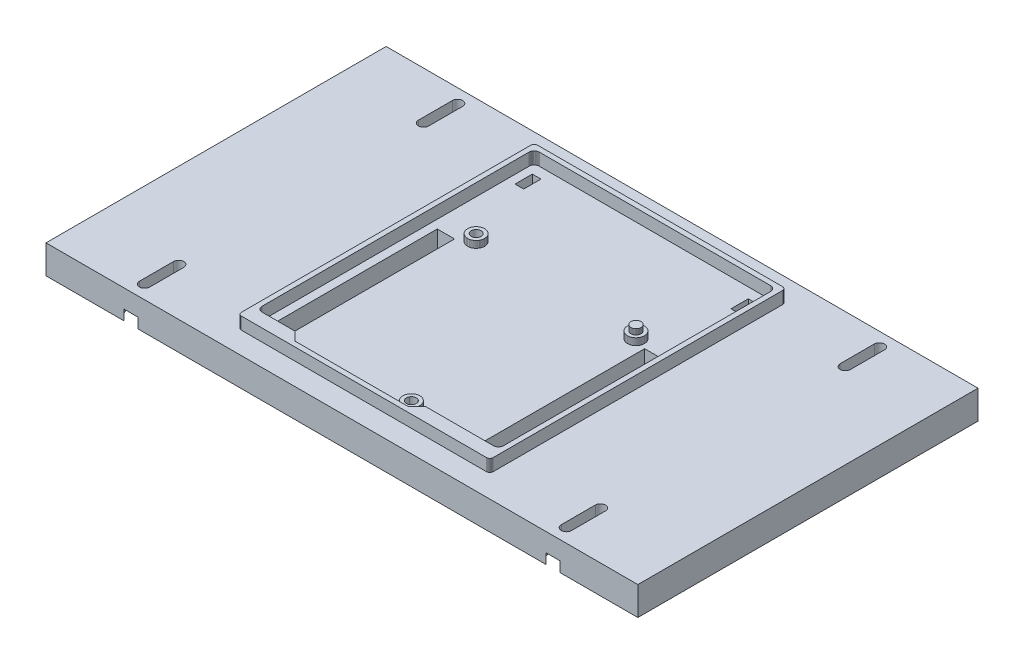
from build123d import *

# Parameters (mm, degrees)
BOSS_EXTRUDE1_DEPTH     = 12.000000104
CUT_EXTRUDE1_DEPTH      = 3.600000404
BOSS_EXTRUDE2_DEPTH     = 2.000000328
BOSS_EXTRUDE3_DEPTH     = 1.600000076
BOSS_EXTRUDE4_DEPTH     = 2.000000328
CUT_EXTRUDE2_DEPTH      = 8.399999933
BOSS_EXTRUDE5_DEPTH     = 2.000000328
CUT_EXTRUDE3_DEPTH      = 8.399999933
SKETCH9_W               = 2.539999783
SKETCH9_H               = 5.079999566
CUT_EXTRUDE4_DEPTH      = 6.399999605
SKETCH10_W              = 5.079999566
SKETCH10_H              = 48.259995878
CUT_EXTRUDE5_DEPTH      = 6.399999605
SKETCH11_W              = 2.540001646
SKETCH11_H              = 5.079999566
CUT_EXTRUDE6_DEPTH      = 6.399999605
SKETCH12_W              = 5.080001429
SKETCH12_H              = 48.259995878
CUT_EXTRUDE7_DEPTH      = 6.399999605
SKETCH13_W              = 174.000000954
SKETCH13_H              = 100
BOSS_EXTRUDE6_DEPTH     = 8.3999997
CUT_EXTRUDE8_DEPTH      = 156.634156294
CUT_EXTRUDE8_DEPTH_BACK = 156.634156294
SKETCH14_R              = 1.450002193
CUT_EXTRUDE9_DEPTH      = 3
CUT_EXTRUDE9_DEPTH_BACK = 156.634156294
CUT_EXTRUDE9_START      = -2
SKETCH14_4_R            = 5


with BuildPart() as part:
    # Sketch1 → Boss-Extrude1 (new body)
    with BuildSketch(Plane.XZ):
        Polygon((72.999998927, 87.039999664), (1.000002027, 87.039999664), (0.826351345, 87.02480793), (0.657979341, 86.979687214), (0.500001013, 86.906030774), (0.357214361, 86.806043983), (0.233955681, 86.682789028), (0.13397634, 86.539998651), (0.060308725, 86.38201654), (0.015191734, 86.213648319), (0, 86.039997637), (0, 0.999998301), (0.015191734, 0.826351345), (0.060308725, 0.657979341), (0.13397634, 0.500001013), (0.233955681, 0.357210636), (0.357214361, 0.233955681), (0.500001013, 0.133972615), (0.657979341, 0.060308725), (0.826351345, 0.015191734), (1.000002027, 0), (72.999998927, 0), (73.173649609, 0.015191734), (73.342017829, 0.060308725), (73.49999994, 0.133972615), (73.642782867, 0.233955681), (73.766045272, 0.357210636), (73.866024613, 0.500001013), (73.939688504, 0.657979341), (73.98480922, 0.826351345), (74.000000954, 0.999998301), (74.000000954, 86.039997637), (73.98480922, 86.213648319), (73.939688504, 86.38201654), (73.866024613, 86.539998651), (73.766045272, 86.682789028), (73.642782867, 86.806043983), (73.49999994, 86.906030774), (73.342017829, 86.979687214), (73.173649609, 87.02480793), align=None)
    extrude(amount=-BOSS_EXTRUDE1_DEPTH)

    # Sketch2 → Cut-Extrude1 (cut)
    with BuildSketch(Plane(origin=(0, 12.000000104, 0), x_dir=(-1, 0, 0), z_dir=(0, 1, 0))):
        Polygon((-72.477214038, 81.760473549), (-72.499997914, 81.500001252), (-72.499997914, 2.999998629), (-72.481527925, 2.765346318), (-72.426579893, 2.536475658), (-72.336509824, 2.319015563), (-72.21352309, 2.118322998), (-72.060659528, 1.939341426), (-71.88167423, 1.786474138), (-71.680985391, 1.66349113), (-71.463525295, 1.57341361), (-71.23465091, 1.518465462), (-71.000002325, 1.499999315), (-2.999998629, 1.499999315), (-2.765350044, 1.518465462), (-2.536475658, 1.57341361), (-2.319015563, 1.66349113), (-2.118322998, 1.786474138), (-1.939341426, 1.939341426), (-1.786474138, 2.118322998), (-1.66349113, 2.319015563), (-1.573417336, 2.536475658), (-1.518469304, 2.765346318), (-1.499999315, 2.999998629), (-1.499999315, 81.500001252), (-1.522790641, 81.760473549), (-1.590460539, 82.01303333), (-1.700963825, 82.249999046), (-1.850932837, 82.464180887), (-2.035818994, 82.649067044), (-2.250001067, 82.799039781), (-2.486970276, 82.909539342), (-2.739530057, 82.977212965), (-2.999998629, 82.999996841), (-12.662893161, 82.999996841), (-15.202892944, 85.540004075), (-48.617105931, 85.540004075), (-51.157109439, 82.999996841), (-71.000002325, 82.999996841), (-71.260467172, 82.977212965), (-71.513034403, 82.909539342), (-71.750000119, 82.799039781), (-71.96418196, 82.649067044), (-72.149068117, 82.464180887), (-72.299033403, 82.249999046), (-72.409540415, 82.01303333), align=None)
    extrude(amount=-CUT_EXTRUDE1_DEPTH, mode=Mode.SUBTRACT)

    # Sketch3 → Boss-Extrude2 (add)
    with BuildSketch(Plane(origin=(0, 8.3999997, 0), x_dir=(-1, 0, 0), z_dir=(0, 1, 0))):
        Polygon((-60.695879161, 33.662017435), (-60.274947435, 33.549234271), (-59.879999608, 33.365063369), (-59.523031116, 33.115111291), (-59.214890003, 32.806970179), (-58.9649342, 32.450001687), (-58.780770749, 32.055050135), (-58.667980134, 31.634122133), (-58.6300008, 31.200001016), (-58.667980134, 30.765878037), (-58.780770749, 30.344950035), (-58.9649342, 29.949998483), (-59.214890003, 29.593031853), (-59.523031116, 29.284888878), (-59.879999608, 29.034934938), (-60.274947435, 28.850769624), (-60.695879161, 28.737980872), (-61.130002141, 28.699999675), (-61.564121395, 28.737980872), (-61.985049397, 28.850769624), (-62.380000949, 29.034934938), (-62.736965716, 29.284888878), (-63.045114279, 29.593031853), (-63.295066357, 29.949998483), (-63.479229808, 30.344950035), (-63.592024148, 30.765878037), (-63.629999757, 31.200001016), (-63.592024148, 31.634122133), (-63.479229808, 32.055050135), (-63.295066357, 32.450001687), (-63.045114279, 32.806970179), (-62.736965716, 33.115111291), (-62.380000949, 33.365063369), (-61.985049397, 33.549234271), (-61.564121395, 33.662017435), (-61.130002141, 33.700000495), align=None)
    extrude(amount=BOSS_EXTRUDE2_DEPTH)

    # Sketch4 → Boss-Extrude3 (add)
    with BuildSketch(Plane(origin=(0, 10.400000028, 0), x_dir=(-1, 0, 0), z_dir=(0, 1, 0))):
        Polygon((-61.130002141, 32.700002193), (-60.869529843, 32.677210867), (-60.616970062, 32.609537244), (-60.380000621, 32.499037683), (-60.165818781, 32.349068671), (-59.980932623, 32.164182514), (-59.830963612, 31.950000674), (-59.720464051, 31.713031232), (-59.652790427, 31.460471451), (-59.630002826, 31.200001016), (-59.652790427, 30.939526856), (-59.720464051, 30.686968938), (-59.830963612, 30.449999496), (-59.980932623, 30.235819519), (-60.165818781, 30.050933361), (-60.380000621, 29.900960624), (-60.616970062, 29.790461063), (-60.869529843, 29.72278744), (-61.130002141, 29.699999839), (-61.390470713, 29.72278744), (-61.643030494, 29.790461063), (-61.879999936, 29.900960624), (-62.094181776, 30.050933361), (-62.279067934, 30.235819519), (-62.42904067, 30.449999496), (-62.539540231, 30.686968938), (-62.607213855, 30.939526856), (-62.62999773, 31.200001016), (-62.607213855, 31.460471451), (-62.539540231, 31.713031232), (-62.42904067, 31.950000674), (-62.279067934, 32.164182514), (-62.094181776, 32.349068671), (-61.879999936, 32.499037683), (-61.643030494, 32.609537244), (-61.390470713, 32.677210867), align=None)
    extrude(amount=BOSS_EXTRUDE3_DEPTH)

    # Sketch5 → Boss-Extrude4 (add)
    with BuildSketch(Plane(origin=(0, 8.3999997, 0), x_dir=(-1, 0, 0), z_dir=(0, 1, 0))):
        Polygon((-14.476969838, 28.014888987), (-14.785110019, 28.323030099), (-15.035064891, 28.680000454), (-15.219232067, 29.074950144), (-15.332018957, 29.495878145), (-15.370000154, 29.930001125), (-15.332018957, 30.364120379), (-15.219232067, 30.785050243), (-15.035064891, 31.179999933), (-14.785110019, 31.536966562), (-14.476969838, 31.8451114), (-14.120001346, 32.095063478), (-13.725051656, 32.279230654), (-13.304121792, 32.392021269), (-12.870000675, 32.430000603), (-12.435879558, 32.392021269), (-12.014949694, 32.279230654), (-11.620000005, 32.095063478), (-11.263031512, 31.8451114), (-10.954888538, 31.536966562), (-10.70493646, 31.179999933), (-10.520769283, 30.785050243), (-10.407980531, 30.364120379), (-10.370001197, 29.930001125), (-10.407980531, 29.495878145), (-10.520769283, 29.074950144), (-10.70493646, 28.680000454), (-10.954888538, 28.323030099), (-11.263031512, 28.014888987), (-11.620000005, 27.764936909), (-12.014949694, 27.58076787), (-12.435879558, 27.467980981), (-12.870000675, 27.429999784), (-13.304121792, 27.467980981), (-13.725051656, 27.58076787), (-14.120001346, 27.764936909), align=None)
    extrude(amount=BOSS_EXTRUDE4_DEPTH)

    # Sketch6 → Cut-Extrude2 (cut)
    with BuildSketch(Plane(origin=(0, 10.400000028, 0), x_dir=(-1, 0, 0), z_dir=(0, 1, 0))):
        Polygon((-12.870000675, 28.479998931), (-12.618210167, 28.502028435), (-12.374071404, 28.567446396), (-12.144999579, 28.674263507), (-11.93795912, 28.819235042), (-11.759236455, 28.997957706), (-11.614263989, 29.205000028), (-11.507445946, 29.434069991), (-11.442029849, 29.678208753), (-11.420000345, 29.930001125), (-11.442029849, 30.181789771), (-11.507445946, 30.425930396), (-11.614263989, 30.654998496), (-11.759236455, 30.862040818), (-11.93795912, 31.040763482), (-12.144999579, 31.18573688), (-12.374071404, 31.292553991), (-12.618210167, 31.357970089), (-12.870000675, 31.37999773), (-13.121791184, 31.357970089), (-13.365929946, 31.292553991), (-13.594999909, 31.18573688), (-13.802042231, 31.040763482), (-13.980764896, 30.862040818), (-14.12573643, 30.654998496), (-14.232555404, 30.425930396), (-14.297971502, 30.181789771), (-14.320001006, 29.930001125), (-14.297971502, 29.678208753), (-14.232555404, 29.434069991), (-14.12573643, 29.205000028), (-13.980764896, 28.997957706), (-13.802042231, 28.819235042), (-13.594999909, 28.674263507), (-13.365929946, 28.567446396), (-13.121791184, 28.502028435), align=None)
    extrude(amount=-CUT_EXTRUDE2_DEPTH, mode=Mode.SUBTRACT)

    # Sketch7 → Boss-Extrude5 (add)
    with BuildSketch(Plane(origin=(0, 8.3999997, 0), x_dir=(-1, 0, 0), z_dir=(0, 1, 0))):
        Polygon((-46.324118972, 79.537980258), (-46.745050699, 79.650767148), (-47.139998525, 79.834938049), (-47.496970743, 80.084890127), (-47.805111855, 80.39303124), (-48.055063933, 80.750003457), (-48.23923111, 81.144951284), (-48.352021724, 81.565879285), (-48.390001059, 82.000002265), (-48.352021724, 82.434117794), (-48.23923111, 82.855045795), (-48.055063933, 83.250001073), (-47.805111855, 83.60697329), (-47.496970743, 83.915106952), (-47.139998525, 84.16505903), (-46.745050699, 84.349229932), (-46.324118972, 84.462024271), (-45.889999717, 84.499999881), (-45.455880463, 84.462024271), (-45.034948736, 84.349229932), (-44.64000091, 84.16505903), (-44.283032417, 83.915106952), (-43.97488758, 83.60697329), (-43.724939227, 83.250001073), (-43.540768325, 82.855045795), (-43.427981436, 82.434117794), (-43.389998376, 82.000002265), (-43.427981436, 81.565879285), (-43.540768325, 81.144951284), (-43.724939227, 80.750003457), (-43.97488758, 80.39303124), (-44.283032417, 80.084890127), (-44.64000091, 79.834938049), (-45.034948736, 79.650767148), (-45.455880463, 79.537980258), (-45.889999717, 79.499997199), align=None)
    extrude(amount=BOSS_EXTRUDE5_DEPTH)

    # Sketch8 → Cut-Extrude3 (cut)
    with BuildSketch(Plane(origin=(0, 10.400000028, 0), x_dir=(-1, 0, 0), z_dir=(0, 1, 0))):
        Polygon((-44.462028891, 82.251794636), (-44.527444988, 82.495927811), (-44.634260237, 82.724995911), (-44.77923736, 82.932040095), (-44.957958162, 83.110764623), (-45.165002346, 83.25573802), (-45.394070446, 83.362556994), (-45.638211071, 83.427973092), (-45.889999717, 83.449997008), (-46.141788363, 83.427973092), (-46.385928988, 83.362556994), (-46.615000814, 83.25573802), (-46.822041273, 83.110764623), (-47.0007658, 82.932040095), (-47.145735472, 82.724995911), (-47.252554446, 82.495927811), (-47.317970544, 82.251794636), (-47.340001911, 82.000002265), (-47.317970544, 81.748209894), (-47.252554446, 81.504069269), (-47.145735472, 81.275001168), (-47.0007658, 81.067956984), (-46.822041273, 80.889239907), (-46.615000814, 80.744259059), (-46.385928988, 80.637440085), (-46.141788363, 80.572031438), (-45.889999717, 80.550000072), (-45.638211071, 80.572031438), (-45.394070446, 80.637440085), (-45.165002346, 80.744259059), (-44.957958162, 80.889239907), (-44.77923736, 81.067956984), (-44.634260237, 81.275001168), (-44.527444988, 81.504069269), (-44.462028891, 81.748209894), (-44.439997524, 82.000002265), align=None)
    extrude(amount=-CUT_EXTRUDE3_DEPTH, mode=Mode.SUBTRACT)

    # Sketch9 → Cut-Extrude4 (cut)
    with BuildSketch(Plane(origin=(0, 8.3999997, 0), x_dir=(-1, 0, 0), z_dir=(0, 1, 0))):
        with Locations((-68.750005216, 7.070001215)):
            Rectangle(SKETCH9_W, SKETCH9_H)
    extrude(amount=-CUT_EXTRUDE4_DEPTH, mode=Mode.SUBTRACT)

    # Sketch10 → Cut-Extrude5 (cut)
    with BuildSketch(Plane(origin=(0, 8.3999997, 0), x_dir=(-1, 0, 0), z_dir=(0, 1, 0))):
        with Locations((-67.480005324, 56.600000709)):
            Rectangle(SKETCH10_W, SKETCH10_H)
    extrude(amount=-CUT_EXTRUDE5_DEPTH, mode=Mode.SUBTRACT)

    # Sketch11 → Cut-Extrude6 (cut)
    with BuildSketch(Plane(origin=(0, 8.3999997, 0), x_dir=(-1, 0, 0), z_dir=(0, 1, 0))):
        with Locations((-5.250000395, 7.070001215)):
            Rectangle(SKETCH11_W, SKETCH11_H)
    extrude(amount=-CUT_EXTRUDE6_DEPTH, mode=Mode.SUBTRACT)

    # Sketch12 → Cut-Extrude7 (cut)
    with BuildSketch(Plane(origin=(0, 8.3999997, 0), x_dir=(-1, 0, 0), z_dir=(0, 1, 0))):
        with Locations((-6.520000287, 56.600000709)):
            Rectangle(SKETCH12_W, SKETCH12_H)
    extrude(amount=-CUT_EXTRUDE7_DEPTH, mode=Mode.SUBTRACT)

    # Sketch13 → Boss-Extrude6 (add)
    with BuildSketch(Plane(origin=(0, 8.3999997, 0), x_dir=(1, 0, 0), z_dir=(0, 1, 0))):
        with Locations((37.000000477, -43.519999832)):
            Rectangle(SKETCH13_W, SKETCH13_H)
        Polygon((73.98480922, -0.826351345), (74.000000954, -0.999998301), (74.000000954, -86.039997637), (73.98480922, -86.213648319), (73.939688504, -86.38201654), (73.866024613, -86.539998651), (73.766045272, -86.682789028), (73.642782867, -86.806043983), (73.49999994, -86.906030774), (73.342017829, -86.979687214), (73.173649609, -87.02480793), (72.999998927, -87.039999664), (1.000002027, -87.039999664), (0.826351345, -87.02480793), (0.657979341, -86.979687214), (0.500001013, -86.906030774), (0.357214361, -86.806043983), (0.233955681, -86.682789028), (0.13397634, -86.539998651), (0.060308725, -86.38201654), (0.015191734, -86.213648319), (0, -86.039997637), (0, -0.999998301), (0.015191734, -0.826351345), (0.060308725, -0.657979341), (0.13397634, -0.500001013), (0.233955681, -0.357210636), (0.357214361, -0.233955681), (0.500001013, -0.133972615), (0.657979341, -0.060308725), (0.826351345, -0.015191734), (1.000002027, 0), (72.999998927, 0), (73.173649609, -0.015191734), (73.342017829, -0.060308725), (73.49999994, -0.133972615), (73.642782867, -0.233955681), (73.766045272, -0.357210636), (73.866024613, -0.500001013), (73.939688504, -0.657979341), align=None, mode=Mode.SUBTRACT)
    extrude(amount=-BOSS_EXTRUDE6_DEPTH)

    # Sketch14 → Cut-Extrude8 (cut, two sides: drawn at the far end of the back side and taken through both)
    with BuildSketch(Plane(origin=(0, 2.000000095, 0), x_dir=(1, 0, 0), z_dir=(0, 1, 0)).offset(-CUT_EXTRUDE8_DEPTH_BACK)):
        with BuildLine():
            Line((-26.5, 2.480000168), (-26.5, -7.519999832))
            ThreePointArc((-26.5, -7.519999832), (-25, -9.019999832), (-23.5, -7.519999832))
            Line((-23.5, -7.519999832), (-23.5, 2.480000168))
            ThreePointArc((-23.5, 2.480000168), (-25, 3.980000168), (-26.5, 2.480000168))
        make_face()
        with BuildLine():
            Line((-26.5, -79.519999832), (-26.5, -89.519999832))
            ThreePointArc((-26.5, -89.519999832), (-25, -91.019999832), (-23.5, -89.519999832))
            Line((-23.5, -89.519999832), (-23.5, -79.519999832))
            ThreePointArc((-23.5, -79.519999832), (-25, -78.019999832), (-26.5, -79.519999832))
        make_face()
        with BuildLine():
            ThreePointArc((100.500000954, -89.519999832), (99.000000954, -91.019999832), (97.500000954, -89.519999832))
            Line((97.500000954, -89.519999832), (97.500000954, -79.519999832))
            ThreePointArc((97.500000954, -79.519999832), (99.000000954, -78.019999832), (100.500000954, -79.519999832))
            Line((100.500000954, -79.519999832), (100.500000954, -89.519999832))
        make_face()
        with Locations(Location((45.889999717, -82.000002265, 0), (0, 0, 270))):
            Circle(SKETCH14_R)
        with Locations(Location((12.870000675, -29.930000193, 0), (0, 0, 270))):
            Circle(SKETCH14_R)
        with BuildLine():
            Line((97.500000954, 2.480000168), (97.500000954, -7.519999832))
            ThreePointArc((97.500000954, -7.519999832), (99.000000954, -9.019999832), (100.500000954, -7.519999832))
            Line((100.500000954, -7.519999832), (100.500000954, 2.480000168))
            ThreePointArc((100.500000954, 2.480000168), (99.000000954, 3.980000168), (97.500000954, 2.480000168))
        make_face()
    extrude(amount=CUT_EXTRUDE8_DEPTH + CUT_EXTRUDE8_DEPTH_BACK, mode=Mode.SUBTRACT)

    # Sketch14<4> → Cut-Extrude9 (cut, two sides: drawn at the far end of the back side and taken through both)
    with BuildSketch(Plane(origin=(0, 2.000000095, 0), x_dir=(1, 0, 0), z_dir=(0, 1, 0)).offset(CUT_EXTRUDE9_START - CUT_EXTRUDE9_DEPTH_BACK)):
        with Locations(Location((45.889999717, -82.000002265, 0), (0, 0, 270))):
            Circle(SKETCH14_4_R)
        with Locations(Location((12.870000675, -29.930000193, 0), (0, 0, 220.359173635))):
            Circle(SKETCH14_4_R)
        with BuildLine():
            Line((-20.5, 2.480000168), (-20.5, -7.519999832))
            ThreePointArc((-20.5, -7.519999832), (-25, -12.019999832), (-29.5, -7.519999832))
            Line((-29.5, -7.519999832), (-29.5, 2.480000168))
            ThreePointArc((-29.5, 2.480000168), (-25, 6.980000168), (-20.5, 2.480000168))
        make_face()
        with BuildLine():
            Line((-20.5, -79.519999832), (-20.5, -89.519999832))
            ThreePointArc((-20.5, -89.519999832), (-25, -94.019999832), (-29.5, -89.519999832))
            Line((-29.5, -89.519999832), (-29.5, -79.519999832))
            ThreePointArc((-29.5, -79.519999832), (-25, -75.019999832), (-20.5, -79.519999832))
        make_face()
        with BuildLine():
            Line((94.500000954, 2.480000168), (94.500000954, -7.519999832))
            ThreePointArc((94.500000954, -7.519999832), (99.000000954, -12.019999832), (103.500000954, -7.519999832))
            Line((103.500000954, -7.519999832), (103.500000954, 2.480000168))
            ThreePointArc((103.500000954, 2.480000168), (99.000000954, 6.980000168), (94.500000954, 2.480000168))
        make_face()
        with BuildLine():
            Line((94.500000954, -79.519999832), (94.500000954, -89.519999832))
            ThreePointArc((94.500000954, -89.519999832), (99.000000954, -94.019999832), (103.500000954, -89.519999832))
            Line((103.500000954, -89.519999832), (103.500000954, -79.519999832))
            ThreePointArc((103.500000954, -79.519999832), (99.000000954, -75.019999832), (94.500000954, -79.519999832))
        make_face()
    extrude(amount=CUT_EXTRUDE9_DEPTH + CUT_EXTRUDE9_DEPTH_BACK, mode=Mode.SUBTRACT)


solid = part.part
